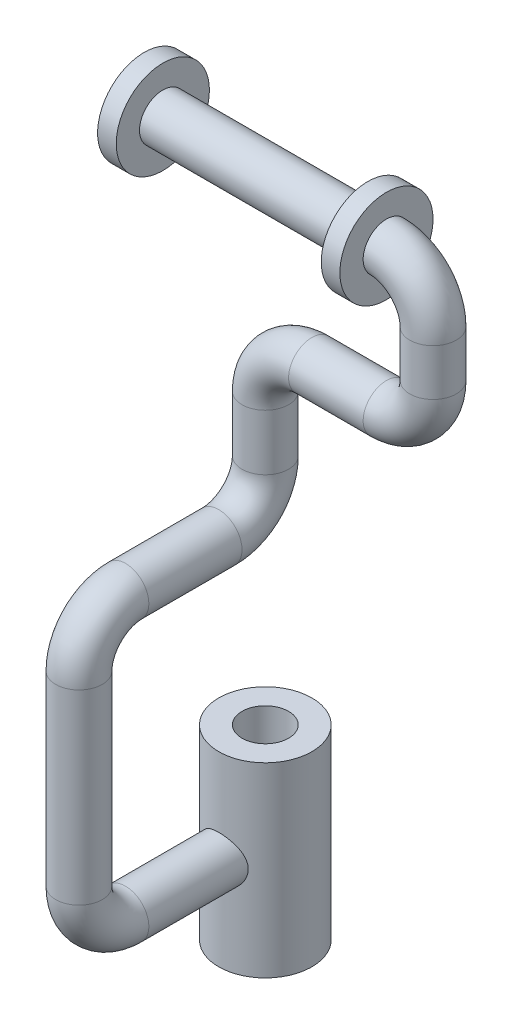
from build123d import *

# Parameters (mm, degrees)
ESQUISSE2_R             = 2.5
ESQUISSE6_R             = 5
BOSS_EXTRU_2_DEPTH      = 2
BOSS_EXTRU_3_START      = -2
ESQUISSE7_R             = 5
BOSS_EXTRU_3_DEPTH      = 2
ESQUISSE9_R             = 2.5
BOSS_EXTRU_4_DEPTH      = 10
BOSS_EXTRU_4_DEPTH_BACK = 10
ESQUISSE10_R            = 5
ENL_V_MAT_EXTRU_1_REACH = 88.049
ESQUISSE11_R            = 2.5


with BuildPart() as part:
    # Balayage1: sweep along a path in Esquisse1
    with BuildLine(Plane.XY) as balayage1_path:
        Line((0, 0), (26, 0))
        ThreePointArc((26, 0), (29.535533906, -1.464466094), (31, -5))
        Line((31, -5), (31, -10))
        ThreePointArc((31, -10), (29.535533906, -13.535533906), (26, -15))
        Line((26, -15), (18, -15))
        ThreePointArc((18, -15), (14.464466094, -16.464466094), (13, -20))
        Line((13, -20), (13, -25))
    # Esquisse2 → Balayage1 (sweep)
    with BuildSketch(Plane(origin=(0, 0, 0), x_dir=(0, 0, -1), z_dir=(1, 0, 0))):
        Circle(ESQUISSE2_R)
    sweep(path=balayage1_path.line)

    # Esquisse6 → Boss.-Extru.2 (add)
    with BuildSketch(Plane(origin=(0, 0, 0), x_dir=(0, 0, -1), z_dir=(1, 0, 0))):
        Circle(ESQUISSE6_R)
    extrude(amount=BOSS_EXTRU_2_DEPTH)

    # Esquisse7 → Boss.-Extru.3 (add)
    with BuildSketch(Plane(origin=(26, 0, 0), x_dir=(0, 0, -1), z_dir=(1, 0, 0)).offset(BOSS_EXTRU_3_START)):
        Circle(ESQUISSE7_R)
    extrude(amount=BOSS_EXTRU_3_DEPTH)

    # Balayage2: sweep along a path in Esquisse8
    with BuildLine(Plane(origin=(13, 0, 0), x_dir=(0, 0, -1), z_dir=(1, 0, 0))) as balayage2_path:
        Line((0, -25), (0, -26))
        ThreePointArc((0, -26), (-1.464466094, -29.535533906), (-5, -31))
        Line((-5, -31), (-15, -31))
        ThreePointArc((-15, -31), (-18.535533906, -32.464466094), (-20, -36))
        Line((-20, -36), (-20, -56))
        ThreePointArc((-20, -56), (-18.535533906, -59.535533906), (-15, -61))
        Line((-15, -61), (0, -61))
    # Esquisse9 → Balayage2 (sweep)
    with BuildSketch(Plane(origin=(0, -25, 0), x_dir=(-1, 0, 0), z_dir=(0, -1, 0))):
        with Locations((-13, 0)):
            Circle(ESQUISSE9_R)
    sweep(path=balayage2_path.line)

    # Esquisse10 → Boss.-Extru.4 (add, two sides: drawn at the far end of the back side and taken through both)
    with BuildSketch(Plane(origin=(100.5, -61, 0), x_dir=(0, 0, -1), z_dir=(0, -1, 0)).offset(-BOSS_EXTRU_4_DEPTH_BACK)):
        with Locations((0, -87.5)):
            Circle(ESQUISSE10_R)
    extrude(amount=BOSS_EXTRU_4_DEPTH + BOSS_EXTRU_4_DEPTH_BACK)

    # Esquisse11 → Enlèv. mat.-Extru.1 (cut, up to next)
    with BuildSketch(Plane(origin=(0, -71, 0), x_dir=(0, 0, -1), z_dir=(0, -1, 0)), mode=Mode.PRIVATE) as enl_v_mat_extru_1_sk1:
        with Locations((0, 13)):
            Circle(ESQUISSE11_R)
    enl_v_mat_extru_1_tool1 = extrude(enl_v_mat_extru_1_sk1.sketch, amount=-ENL_V_MAT_EXTRU_1_REACH, mode=Mode.PRIVATE) & part.part
    add(enl_v_mat_extru_1_tool1.solids().sort_by_distance((13, -71, 0))[0], mode=Mode.SUBTRACT)


solid = part.part
